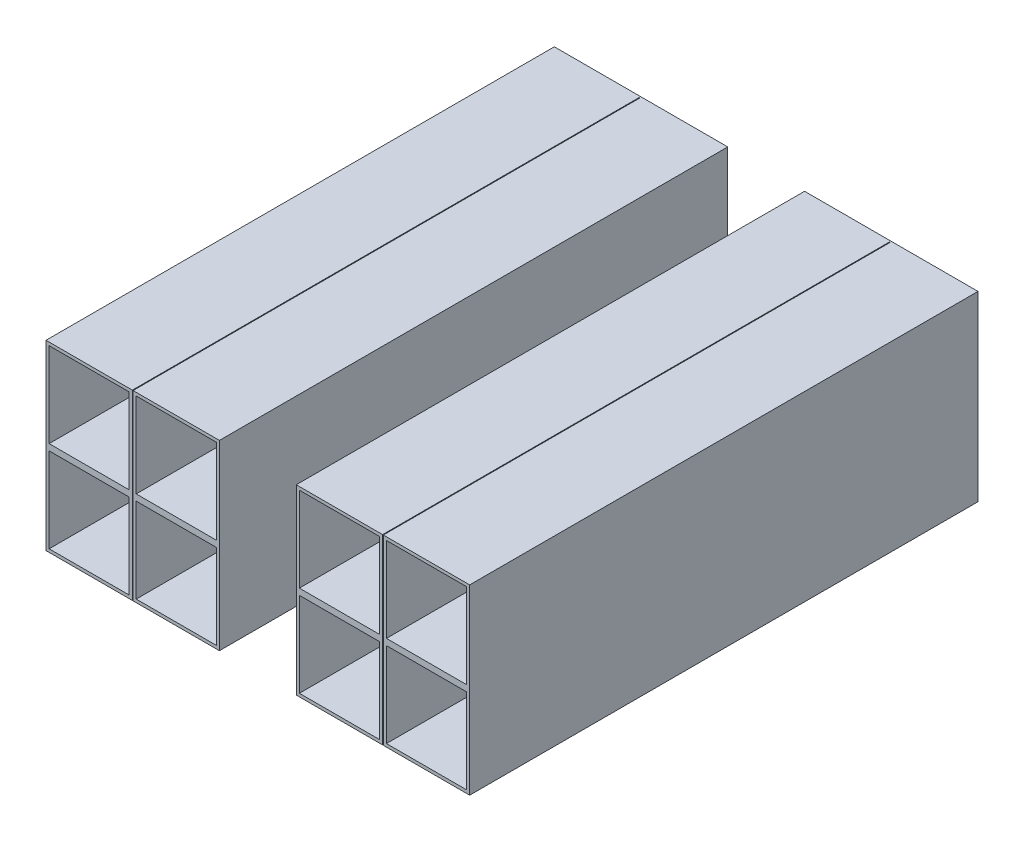
from build123d import *

# Parameters (mm, degrees)
SKETCH1_W             = 138
SKETCH1_H             = 291.176
SKETCH1_W_2           = 128
SKETCH1_H_2           = 135.588
BOSS_EXTRUDE1_DEPTH   = 405
BOSS_EXTRUDE1_2_DEPTH = 405
BOSS_EXTRUDE1_3_DEPTH = 405
BOSS_EXTRUDE1_4_DEPTH = 405
SKETCH2_W             = 277.2
SKETCH2_H             = 291.176
BOSS_EXTRUDE2_DEPTH   = 2.5


with BuildPart() as part:
    # Sketch1 → Boss-Extrude1 (new, symmetric)
    with BuildSketch(Plane.XY):
        with Locations((130.4, 0)):
            Rectangle(SKETCH1_W, SKETCH1_H)
        with Locations((130.4, 72.794)):
            Rectangle(SKETCH1_W_2, SKETCH1_H_2, mode=Mode.SUBTRACT)
        with Locations((130.4, -72.794)):
            Rectangle(SKETCH1_W_2, SKETCH1_H_2, mode=Mode.SUBTRACT)
    extrude(amount=BOSS_EXTRUDE1_DEPTH, both=True)



with BuildPart() as body_2:
    # Sketch1 → Boss-Extrude1 2 (new, symmetric)
    with BuildSketch(Plane.XY):
        with Locations((269.6, 0)):
            Rectangle(SKETCH1_W, SKETCH1_H)
        with Locations((269.6, -72.794)):
            Rectangle(SKETCH1_W_2, SKETCH1_H_2, mode=Mode.SUBTRACT)
        with Locations((269.6, 72.794)):
            Rectangle(SKETCH1_W_2, SKETCH1_H_2, mode=Mode.SUBTRACT)
    extrude(amount=BOSS_EXTRUDE1_2_DEPTH, both=True)


with BuildPart() as body_3:
    # Sketch1 → Boss-Extrude1 3 (new, symmetric)
    with BuildSketch(Plane.XY):
        with Locations((-269.6, 0)):
            Rectangle(SKETCH1_W, SKETCH1_H)
        with Locations((-269.6, -72.794)):
            Rectangle(SKETCH1_W_2, SKETCH1_H_2, mode=Mode.SUBTRACT)
        with Locations((-269.6, 72.794)):
            Rectangle(SKETCH1_W_2, SKETCH1_H_2, mode=Mode.SUBTRACT)
    extrude(amount=BOSS_EXTRUDE1_3_DEPTH, both=True)


with BuildPart() as body_4:
    # Sketch1 → Boss-Extrude1 4 (new, symmetric)
    with BuildSketch(Plane.XY):
        with Locations((-130.4, 0)):
            Rectangle(SKETCH1_W, SKETCH1_H)
        with Locations((-130.4, -72.794)):
            Rectangle(SKETCH1_W_2, SKETCH1_H_2, mode=Mode.SUBTRACT)
        with Locations((-130.4, 72.794)):
            Rectangle(SKETCH1_W_2, SKETCH1_H_2, mode=Mode.SUBTRACT)
    extrude(amount=BOSS_EXTRUDE1_4_DEPTH, both=True)


with BuildPart() as part_1:
    add(part.part)

    add(body_2.part)  # Boss-Extrude2 merges body 2

    add(body_3.part)  # Boss-Extrude2 merges body 3

    add(body_4.part)  # Boss-Extrude2 merges body 4
    # Sketch2 → Boss-Extrude2 (add)
    with BuildSketch(Plane(origin=(0, 0, -405), x_dir=(-1, 0, 0), z_dir=(0, 0, -1))):
        with Locations((-200, 0)):
            Rectangle(SKETCH2_W, SKETCH2_H)
        with Locations((200, 0)):
            Rectangle(SKETCH2_W, SKETCH2_H)
    extrude(amount=BOSS_EXTRUDE2_DEPTH)


solid = part_1.part
